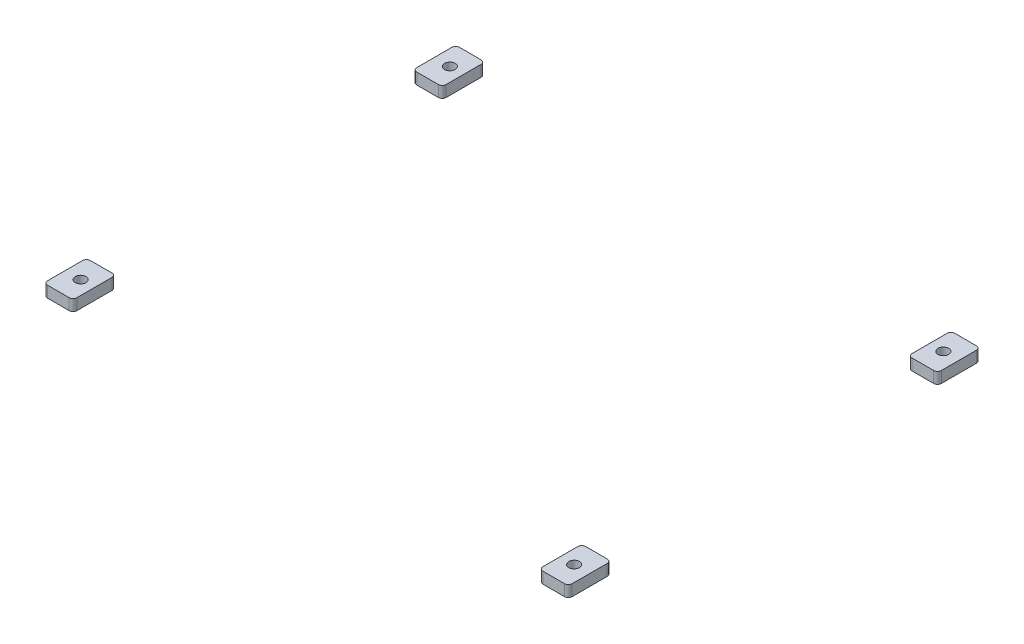
from build123d import *

# Parameters (mm, degrees)
SKETCH1_R             = 2.75
BOSS_EXTRUDE1_DEPTH   = 2.9
BOSS_EXTRUDE1_2_DEPTH = 2.9
BOSS_EXTRUDE1_3_DEPTH = 2.9
BOSS_EXTRUDE1_4_DEPTH = 2.9
SKETCH2_R             = 2.75
BOSS_EXTRUDE2_DEPTH   = 2.9


with BuildPart() as part:
    # Sketch1 → Boss-Extrude1 (new body)
    with BuildSketch(Plane(origin=(0, -2.9, 0), x_dir=(1, 0, 0), z_dir=(0, 1, 0))):
        with BuildLine():
            Line((121.9, -106), (133, -106))
            ThreePointArc((133, -106), (134.414213562, -105.414213562), (135, -104))
            Line((135, -104), (135, -86))
            ThreePointArc((135, -86), (134.414213562, -84.585786438), (133, -84))
            Line((133, -84), (121.9, -84))
            ThreePointArc((121.9, -84), (120.485786438, -84.585786438), (119.9, -86))
            Line((119.9, -86), (119.9, -104))
            ThreePointArc((119.9, -104), (120.485786438, -105.414213562), (121.9, -106))
        make_face()
        with Locations(Location((127, -95, 0), (0, 0, 270))):
            Circle(SKETCH1_R, mode=Mode.SUBTRACT)
    extrude(amount=BOSS_EXTRUDE1_DEPTH)



with BuildPart() as body_2:
    # Sketch1 → Boss-Extrude1 2 (new body)
    with BuildSketch(Plane(origin=(0, -2.9, 0), x_dir=(1, 0, 0), z_dir=(0, 1, 0))):
        with BuildLine():
            Line((121.9, 84), (133, 84))
            ThreePointArc((133, 84), (134.414213562, 84.585786438), (135, 86))
            Line((135, 86), (135, 104))
            ThreePointArc((135, 104), (134.414213562, 105.414213562), (133, 106))
            Line((133, 106), (121.9, 106))
            ThreePointArc((121.9, 106), (120.485786438, 105.414213562), (119.9, 104))
            Line((119.9, 104), (119.9, 86))
            ThreePointArc((119.9, 86), (120.485786438, 84.585786438), (121.9, 84))
        make_face()
        with Locations(Location((127, 95, 0), (0, 0, 270))):
            Circle(SKETCH1_R, mode=Mode.SUBTRACT)
    extrude(amount=BOSS_EXTRUDE1_2_DEPTH)


with BuildPart() as body_3:
    # Sketch1 → Boss-Extrude1 3 (new body)
    with BuildSketch(Plane(origin=(0, -2.9, 0), x_dir=(1, 0, 0), z_dir=(0, 1, 0))):
        with BuildLine():
            Line((-133, -106), (-121.9, -106))
            ThreePointArc((-121.9, -106), (-120.485786438, -105.414213562), (-119.9, -104))
            Line((-119.9, -104), (-119.9, -86))
            ThreePointArc((-119.9, -86), (-120.485786438, -84.585786438), (-121.9, -84))
            Line((-121.9, -84), (-133, -84))
            ThreePointArc((-133, -84), (-134.414213562, -84.585786438), (-135, -86))
            Line((-135, -86), (-135, -104))
            ThreePointArc((-135, -104), (-134.414213562, -105.414213562), (-133, -106))
        make_face()
        with Locations(Location((-127, -95, 0), (0, 0, 270))):
            Circle(SKETCH1_R, mode=Mode.SUBTRACT)
    extrude(amount=BOSS_EXTRUDE1_3_DEPTH)


with BuildPart() as body_4:
    # Sketch1 → Boss-Extrude1 4 (new body)
    with BuildSketch(Plane(origin=(0, -2.9, 0), x_dir=(1, 0, 0), z_dir=(0, 1, 0))):
        with BuildLine():
            Line((-133, 84), (-121.9, 84))
            ThreePointArc((-121.9, 84), (-120.485786438, 84.585786438), (-119.9, 86))
            Line((-119.9, 86), (-119.9, 104))
            ThreePointArc((-119.9, 104), (-120.485786438, 105.414213562), (-121.9, 106))
            Line((-121.9, 106), (-133, 106))
            ThreePointArc((-133, 106), (-134.414213562, 105.414213562), (-135, 104))
            Line((-135, 104), (-135, 86))
            ThreePointArc((-135, 86), (-134.414213562, 84.585786438), (-133, 84))
        make_face()
        with Locations(Location((-127, 95, 0), (0, 0, 270))):
            Circle(SKETCH1_R, mode=Mode.SUBTRACT)
    extrude(amount=BOSS_EXTRUDE1_4_DEPTH)


with BuildPart() as part_1:
    add(part.part)

    add(body_2.part)  # Boss-Extrude2 merges body 2

    add(body_3.part)  # Boss-Extrude2 merges body 3

    add(body_4.part)  # Boss-Extrude2 merges body 4
    # Sketch2 → Boss-Extrude2 (add)
    # profile 1 of 4: a face of its own
    with BuildSketch(Plane(origin=(0, -5.8, 0), x_dir=(1, 0, 0), z_dir=(0, 1, 0))):
        with BuildLine():
            Line((121.9, -106), (133, -106))
            ThreePointArc((133, -106), (134.414213562, -105.414213562), (135, -104))
            Line((135, -104), (135, -86))
            ThreePointArc((135, -86), (134.414213562, -84.585786438), (133, -84))
            Line((133, -84), (121.9, -84))
            ThreePointArc((121.9, -84), (120.485786438, -84.585786438), (119.9, -86))
            Line((119.9, -86), (119.9, -104))
            ThreePointArc((119.9, -104), (120.485786438, -105.414213562), (121.9, -106))
        make_face()
        with Locations(Location((127, -95, 0), (0, 0, 270))):
            Circle(SKETCH2_R, mode=Mode.SUBTRACT)
    # profile 2 of 4: a face of its own
    with BuildSketch(Plane(origin=(0, -5.8, 0), x_dir=(1, 0, 0), z_dir=(0, 1, 0))):
        with BuildLine():
            Line((121.9, 84), (133, 84))
            ThreePointArc((133, 84), (134.414213562, 84.585786438), (135, 86))
            Line((135, 86), (135, 104))
            ThreePointArc((135, 104), (134.414213562, 105.414213562), (133, 106))
            Line((133, 106), (121.9, 106))
            ThreePointArc((121.9, 106), (120.485786438, 105.414213562), (119.9, 104))
            Line((119.9, 104), (119.9, 86))
            ThreePointArc((119.9, 86), (120.485786438, 84.585786438), (121.9, 84))
        make_face()
        with Locations(Location((127, 95, 0), (0, 0, 270))):
            Circle(SKETCH2_R, mode=Mode.SUBTRACT)
    # profile 3 of 4: a face of its own
    with BuildSketch(Plane(origin=(0, -5.8, 0), x_dir=(1, 0, 0), z_dir=(0, 1, 0))):
        with BuildLine():
            Line((-133, -106), (-121.9, -106))
            ThreePointArc((-121.9, -106), (-120.485786438, -105.414213562), (-119.9, -104))
            Line((-119.9, -104), (-119.9, -86))
            ThreePointArc((-119.9, -86), (-120.485786438, -84.585786438), (-121.9, -84))
            Line((-121.9, -84), (-133, -84))
            ThreePointArc((-133, -84), (-134.414213562, -84.585786438), (-135, -86))
            Line((-135, -86), (-135, -104))
            ThreePointArc((-135, -104), (-134.414213562, -105.414213562), (-133, -106))
        make_face()
        with Locations(Location((-127, -95, 0), (0, 0, 270))):
            Circle(SKETCH2_R, mode=Mode.SUBTRACT)
    # profile 4 of 4: a face of its own
    with BuildSketch(Plane(origin=(0, -5.8, 0), x_dir=(1, 0, 0), z_dir=(0, 1, 0))):
        with BuildLine():
            Line((-133, 84), (-121.9, 84))
            ThreePointArc((-121.9, 84), (-120.485786438, 84.585786438), (-119.9, 86))
            Line((-119.9, 86), (-119.9, 104))
            ThreePointArc((-119.9, 104), (-120.485786438, 105.414213562), (-121.9, 106))
            Line((-121.9, 106), (-133, 106))
            ThreePointArc((-133, 106), (-134.414213562, 105.414213562), (-135, 104))
            Line((-135, 104), (-135, 86))
            ThreePointArc((-135, 86), (-134.414213562, 84.585786438), (-133, 84))
        make_face()
        with Locations(Location((-127, 95, 0), (0, 0, 270))):
            Circle(SKETCH2_R, mode=Mode.SUBTRACT)
    extrude(amount=BOSS_EXTRUDE2_DEPTH)


solid = part_1.part
